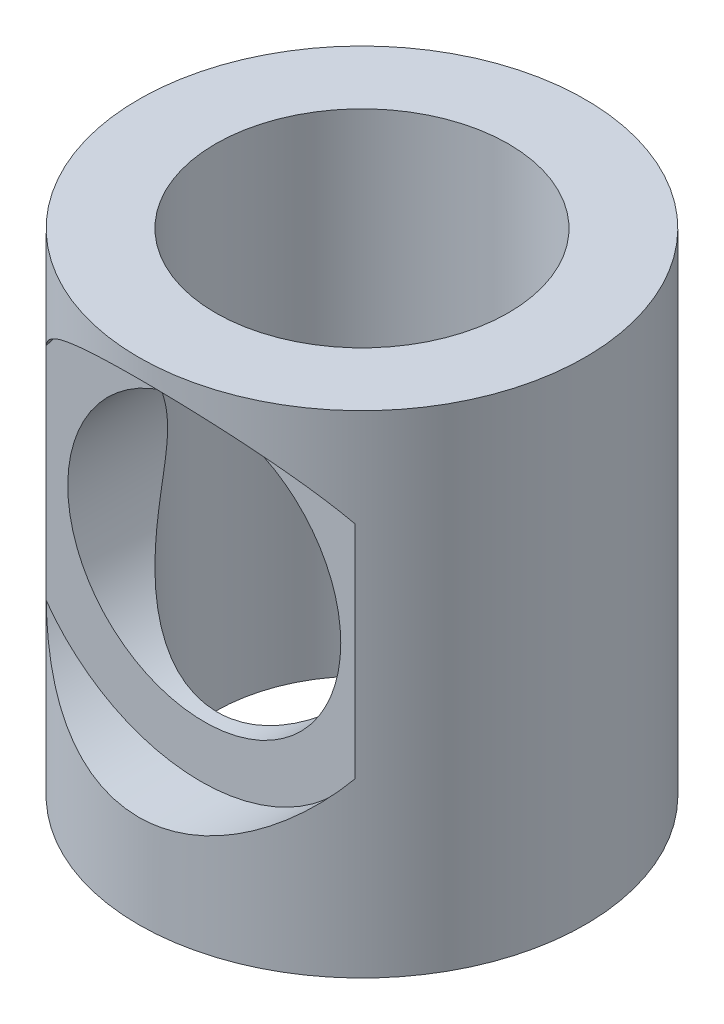
from build123d import *

# Parameters (mm, degrees)
SKETCH1_R               = 9
SKETCH1_R_2             = 5.9
BOSS_EXTRUDE1_DEPTH     = 19.8
CUT_EXTRUDE5_START      = 6.5
SKETCH3_R               = 7.65
CUT_EXTRUDE5_DEPTH      = 18.038054295
CUT_EXTRUDE6_DEPTH      = 27.707489752
CUT_EXTRUDE6_DEPTH_BACK = 7
SKETCH6_R               = 5.5


with BuildPart() as part:
    # Sketch1 → Boss-Extrude1 (new body)
    with BuildSketch(Plane(origin=(0, 0, 0), x_dir=(1, 0, 0), z_dir=(0, 1, 0))):
        with Locations(Location((0, 0, 0), (0, 0, 270))):
            Circle(SKETCH1_R)
        with Locations(Location((0, 0, 0), (0, 0, 270))):
            Circle(SKETCH1_R_2, mode=Mode.SUBTRACT)
    extrude(amount=-BOSS_EXTRUDE1_DEPTH)

    # Sketch3 → Cut-Extrude5 (cut, through all)
    with BuildSketch(Plane.XY.offset(CUT_EXTRUDE5_START)):
        with Locations((0, -8.4)):
            Circle(SKETCH3_R)
    extrude(amount=CUT_EXTRUDE5_DEPTH, mode=Mode.SUBTRACT)

    # Sketch6 → Cut-Extrude6 (cut, two sides: drawn at the far end of the back side and taken through both)
    with BuildSketch(Plane.XY.offset(6.5).offset(-CUT_EXTRUDE6_DEPTH_BACK)):
        with Locations(Location((0.145476138, -8.4, 0), (0, 0, 91.515662264))):
            Circle(SKETCH6_R)
    extrude(amount=CUT_EXTRUDE6_DEPTH + CUT_EXTRUDE6_DEPTH_BACK, mode=Mode.SUBTRACT)


solid = part.part
